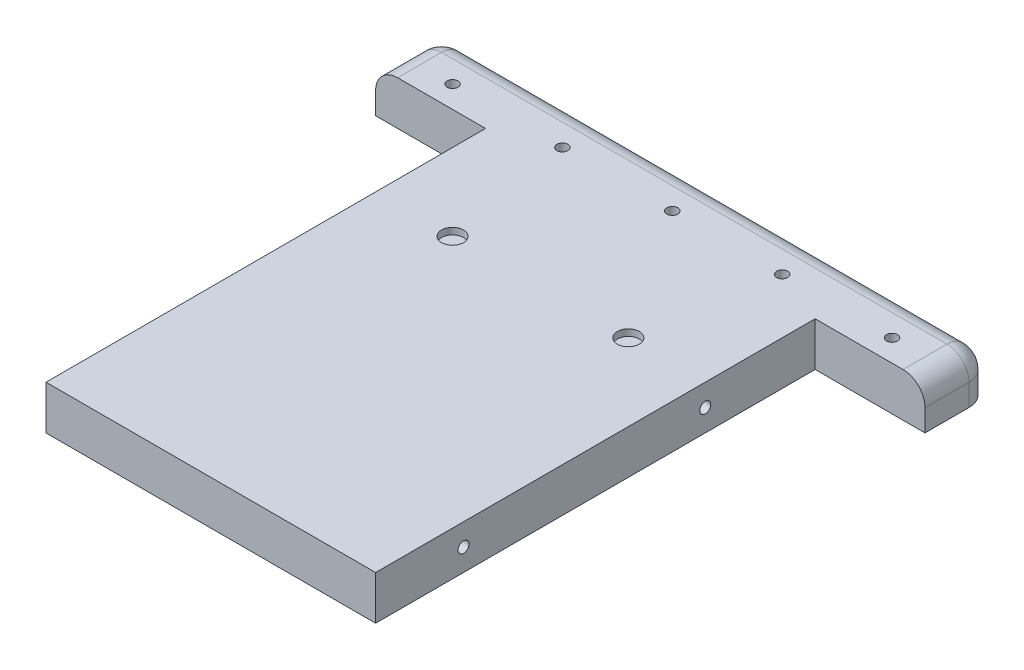
from build123d import *

# Parameters (mm, degrees)
BOSS_EXTRUDE1_DEPTH = 20
SKETCH2_R           = 2.5
CUT_EXTRUDE1_DEPTH  = 240.374184072
SKETCH4_R           = 2.5
CUT_EXTRUDE2_DEPTH  = 5
FILLET1_R           = 10
FILLET2_R           = 10
SKETCH6_R           = 2.5
CUT_EXTRUDE3_DEPTH  = 5
SKETCH8_R           = 5
CUT_EXTRUDE5_DEPTH  = 3


with BuildPart() as part:
    # Sketch1 → Boss-Extrude1 (new body)
    with BuildSketch(Plane(origin=(0, 0, 0), x_dir=(1, 0, 0), z_dir=(0, 1, 0))):
        Polygon((-75, -100), (75, -100), (75, 100), (125, 100), (125, 130), (-125, 130), (-125, 100), (-75, 100), align=None)
    extrude(amount=BOSS_EXTRUDE1_DEPTH)

    # Sketch2 → Cut-Extrude1 (cut, through all)
    with BuildSketch(Plane.ZY.offset(75)):
        with Locations((60, 10)):
            Circle(SKETCH2_R)
        with Locations((-50, 10)):
            Circle(SKETCH2_R)
    extrude(amount=-CUT_EXTRUDE1_DEPTH, mode=Mode.SUBTRACT)

    # Sketch4 → Cut-Extrude2 (cut)
    with BuildSketch(Plane.XZ):
        with Locations(Location((-100, -115, 0), (0, 0, 270))):
            Circle(SKETCH4_R)
        with Locations(Location((-50, -115, 0), (0, 0, 270))):
            Circle(SKETCH4_R)
        with Locations(Location((0, -115, 0), (0, 0, 270))):
            Circle(SKETCH4_R)
        with Locations(Location((50, -115, 0), (0, 0, 90))):
            Circle(SKETCH4_R)
        with Locations(Location((100, -115, 0), (0, 0, 90))):
            Circle(SKETCH4_R)
    extrude(amount=-CUT_EXTRUDE2_DEPTH, mode=Mode.SUBTRACT)

    # Fillet1
    fillet1_edges = [part.edges().sort_by_distance(p)[0] for p in [
        (-125, 10, -130),
        (125, 10, -130),
    ]]
    fillet(fillet1_edges, radius=FILLET1_R)

    # Fillet2
    fillet2_edges = [part.edges().sort_by_distance(p)[0] for p in [
        (125, 20, -110),
        (0, 20, -130),
        (-125, 20, -110),
        (-122.071067812, 20, -127.071067812),
        (122.071067812, 20, -127.071067812),
    ]]
    fillet(fillet2_edges, radius=FILLET2_R)

    # Sketch6 → Cut-Extrude3 (cut)
    with BuildSketch(Plane(origin=(0, 20, 0), x_dir=(1, 0, 0), z_dir=(0, 1, 0))):
        with Locations(Location((0, 110, 0), (0, 0, 270))):
            Circle(SKETCH6_R)
        with Locations(Location((50, 110, 0), (0, 0, 270))):
            Circle(SKETCH6_R)
        with Locations(Location((100, 110, 0), (0, 0, 270))):
            Circle(SKETCH6_R)
        with Locations(Location((-50, 110, 0), (0, 0, 90))):
            Circle(SKETCH6_R)
        with Locations(Location((-100, 110, 0), (0, 0, 90))):
            Circle(SKETCH6_R)
    extrude(amount=-CUT_EXTRUDE3_DEPTH, mode=Mode.SUBTRACT)

    # Sketch8 → Cut-Extrude5 (cut)
    with BuildSketch(Plane(origin=(0, 20, 0), x_dir=(1, 0, 0), z_dir=(0, 1, 0))):
        with Locations(Location((-40, 50, 0), (0, 0, 270))):
            Circle(SKETCH8_R)
        with Locations(Location((40, 50, 0), (0, 0, 90))):
            Circle(SKETCH8_R)
    extrude(amount=-CUT_EXTRUDE5_DEPTH, mode=Mode.SUBTRACT)


solid = part.part
